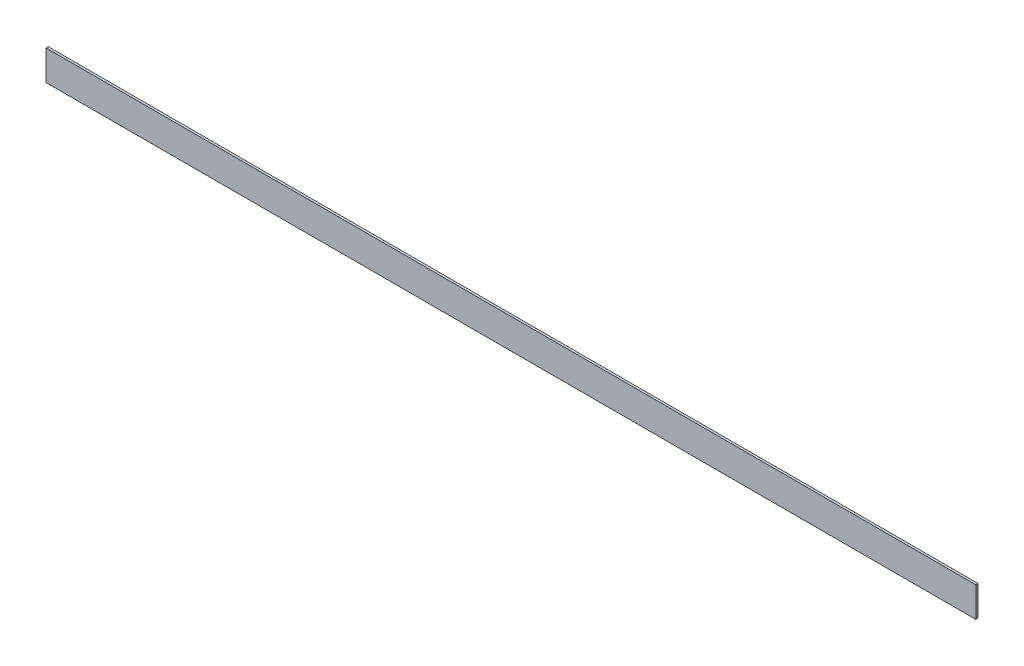
from build123d import *

# Parameters (mm, degrees)
PRESS_UC_RAFI_RAF_BUK_ARKA_1_START = -798.5
SKETCH1_W                          = 620
SKETCH1_H                          = 20
PRESS_UC_RAFI_RAF_BUK_ARKA_1_DEPTH = 1.5


with BuildPart() as part:
    # Sketch1 → PRESS_uc_rafi_raf_buk_arka_1 (new body)
    with BuildSketch(Plane.XY.offset(PRESS_UC_RAFI_RAF_BUK_ARKA_1_START)):
        with Locations((350, 1142)):
            Rectangle(SKETCH1_W, SKETCH1_H)
    extrude(amount=-PRESS_UC_RAFI_RAF_BUK_ARKA_1_DEPTH)


solid = part.part
